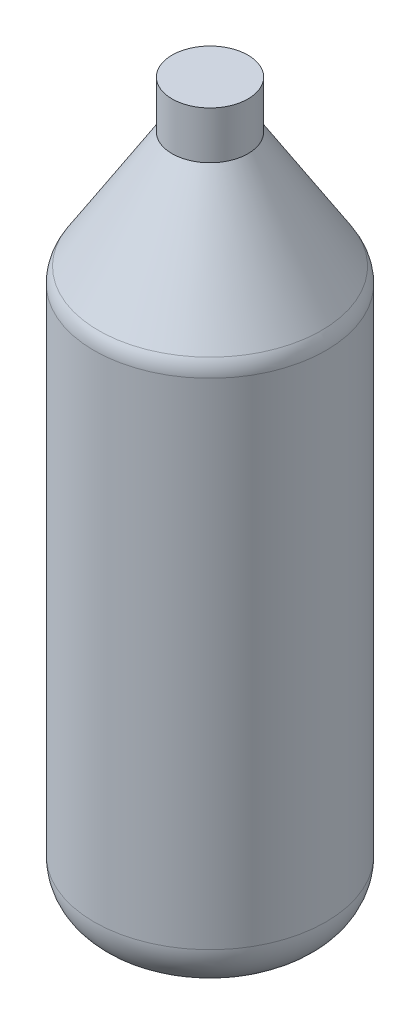
from build123d import *

# Parameters (mm, degrees)
SKETCH1_R           = 30.988
BOSS_EXTRUDE1_DEPTH = 147.32
SKETCH3_R           = 10.16
FILLET3_R           = 7.62
SKETCH8_R           = 10.16
BOSS_EXTRUDE2_DEPTH = 12.7
FILLET4_R           = 12.7


with BuildPart() as part:
    # Sketch1 → Boss-Extrude1 (new body)
    with BuildSketch(Plane(origin=(0, 0, 0), x_dir=(1, 0, 0), z_dir=(0, 1, 0))):
        with Locations(Location((0, 0, 0), (0, 0, 270))):
            Circle(SKETCH1_R)
    extrude(amount=BOSS_EXTRUDE1_DEPTH)

    # Sketch3 → section 1 of loft2
    with BuildSketch(Plane(origin=(0, 180.34, 0), x_dir=(-1, 0, 0), z_dir=(0, -1, 0)), mode=Mode.PRIVATE) as loft2_s1:
        Circle(SKETCH3_R)
    # loft up to a face of the part (loft2)
    loft([Face(Wire([part.edges().sort_by_distance((22.589279827, 147.32, -21.212745719))[0]])), loft2_s1.sketch])

    # Fillet3
    fillet3_edges = [part.edges().sort_by_distance(p)[0] for p in [
        (0, 147.32, -30.988),
    ]]
    fillet(fillet3_edges, radius=FILLET3_R)

    # Sketch8 → Boss-Extrude2 (add)
    with BuildSketch(Plane(origin=(0, 180.34, 0), x_dir=(1, 0, 0), z_dir=(0, 1, 0))):
        with Locations(Location((0, 0, 0), (0, 0, 270))):
            Circle(SKETCH8_R)
    extrude(amount=BOSS_EXTRUDE2_DEPTH)

    # Fillet4
    fillet4_edges = [part.edges().sort_by_distance(p)[0] for p in [
        (0, 0, -30.988),
    ]]
    fillet(fillet4_edges, radius=FILLET4_R)


solid = part.part
